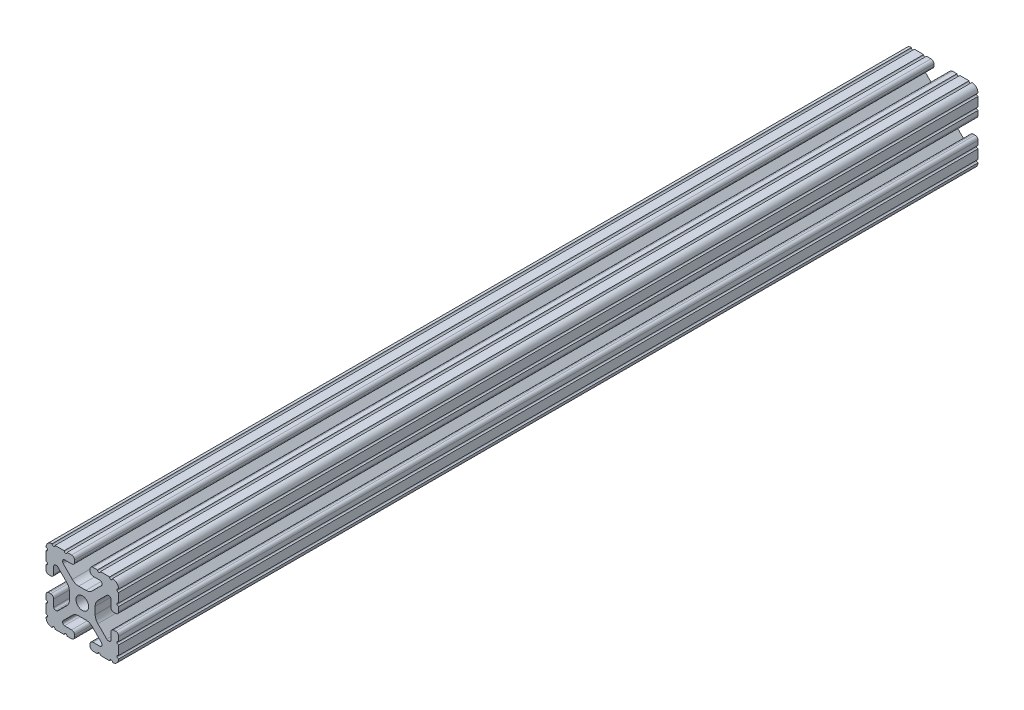
from build123d import *

# Parameters (mm, degrees)
SKETCH1_R      = 3.3274
EXTRUDE1_DEPTH = 450.85


with BuildPart() as part:
    # Sketch1 → Extrude1 (new body)
    with BuildSketch(Plane.XY):
        with BuildLine():
            Line((-10.022898969, 12.91475973), (-5.252158105, 8.144007132))
            ThreePointArc((-5.252158105, 8.144007132), (-3.715177372, 7.117027388), (-1.902183975, 6.7564))
            Line((-1.902183975, 6.7564), (1.902183975, 6.7564))
            ThreePointArc((1.902183975, 6.7564), (3.715177372, 7.117027388), (5.252158105, 8.144007132))
            Line((5.252158105, 8.144007132), (10.022898969, 12.91475973))
            ThreePointArc((10.022898969, 12.91475973), (10.218362387, 13.207291992), (10.287, 13.552357131))
            Line((10.287, 13.552357131), (10.287, 14.0843))
            ThreePointArc((10.287, 14.0843), (10.022898185, 14.721898185), (9.3853, 14.986))
            Line((9.3853, 14.986), (5.617617549, 14.986))
            ThreePointArc((5.617617549, 14.986), (4.519044045, 15.441044045), (4.064, 16.539617549))
            Line((4.064, 16.539617549), (4.064, 17.496382451))
            ThreePointArc((4.064, 17.496382451), (4.519044045, 18.594955955), (5.617617549, 19.05))
            Line((5.617617549, 19.05), (7.974178704, 19.05))
            ThreePointArc((7.974178704, 19.05), (8.736178704, 18.288), (9.498178704, 19.05))
            Line((9.498178704, 19.05), (14.327719207, 19.05))
            ThreePointArc((14.327719207, 19.05), (15.087603123, 18.231251131), (15.847487039, 19.05))
            ThreePointArc((15.847487039, 19.05), (18.120176289, 18.120192083), (19.05, 15.847509295))
            ThreePointArc((19.05, 15.847509295), (18.231250992, 15.08762539), (19.05, 14.327741484))
            Line((19.05, 14.327741484), (19.05, 9.496091471))
            ThreePointArc((19.05, 9.496091471), (18.231250992, 8.736207565), (19.05, 7.97632366))
            Line((19.05, 7.97632366), (19.05, 5.617617549))
            ThreePointArc((19.05, 5.617617549), (18.594955955, 4.519044045), (17.496382451, 4.064))
            Line((17.496382451, 4.064), (16.539617549, 4.064))
            ThreePointArc((16.539617549, 4.064), (15.441044045, 4.519044045), (14.986, 5.617617549))
            Line((14.986, 5.617617549), (14.986, 9.385342516))
            ThreePointArc((14.986, 9.385342516), (14.721898185, 10.022940701), (14.0843, 10.287042516))
            Line((14.0843, 10.287042516), (13.516042086, 10.287042516))
            ThreePointArc((13.516042086, 10.287042516), (13.170975923, 10.218404478), (12.878443117, 10.022939917))
            Line((12.878443117, 10.022939917), (8.14758008, 5.292065243))
            ThreePointArc((8.14758008, 5.292065243), (7.117955879, 3.751120653), (6.7564, 1.933453584))
            Line((6.7564, 1.933453584), (6.7564, -1.933453584))
            ThreePointArc((6.7564, -1.933453584), (7.117955879, -3.751120653), (8.14758008, -5.292065243))
            Line((8.14758008, -5.292065243), (12.878443117, -10.022939917))
            ThreePointArc((12.878443117, -10.022939917), (13.170975923, -10.218404478), (13.516042086, -10.287042516))
            Line((13.516042086, -10.287042516), (14.0843, -10.287042516))
            ThreePointArc((14.0843, -10.287042516), (14.721898185, -10.022940701), (14.986, -9.385342516))
            Line((14.986, -9.385342516), (14.986, -5.617617549))
            ThreePointArc((14.986, -5.617617549), (15.441044045, -4.519044045), (16.539617549, -4.064))
            Line((16.539617549, -4.064), (17.496382451, -4.064))
            ThreePointArc((17.496382451, -4.064), (18.594955955, -4.519044045), (19.05, -5.617617549))
            Line((19.05, -5.617617549), (19.05, -7.976318491))
            ThreePointArc((19.05, -7.976318491), (18.231250992, -8.736202396), (19.05, -9.496086302))
            Line((19.05, -9.496086302), (19.05, -14.32774291))
            ThreePointArc((19.05, -14.32774291), (18.231250992, -15.087626816), (19.05, -15.847510721))
            ThreePointArc((19.05, -15.847510721), (18.120175716, -18.120192644), (15.847486868, -19.05))
            ThreePointArc((15.847486868, -19.05), (15.087602952, -18.231251131), (14.327719036, -19.05))
            Line((14.327719036, -19.05), (9.496062448, -19.05))
            ThreePointArc((9.496062448, -19.05), (8.736178532, -18.231251131), (7.976294616, -19.05))
            Line((7.976294616, -19.05), (5.617617549, -19.05))
            ThreePointArc((5.617617549, -19.05), (4.519044045, -18.594955955), (4.064, -17.496382451))
            Line((4.064, -17.496382451), (4.064, -16.539617549))
            ThreePointArc((4.064, -16.539617549), (4.519044045, -15.441044045), (5.617617549, -14.986))
            Line((5.617617549, -14.986), (9.3853, -14.986))
            ThreePointArc((9.3853, -14.986), (10.022898185, -14.721898185), (10.287, -14.0843))
            Line((10.287, -14.0843), (10.287, -13.552357131))
            ThreePointArc((10.287, -13.552357131), (10.218362387, -13.207291992), (10.022898969, -12.91475973))
            Line((10.022898969, -12.91475973), (5.252158105, -8.144007132))
            ThreePointArc((5.252158105, -8.144007132), (3.715177372, -7.117027388), (1.902183975, -6.7564))
            Line((1.902183975, -6.7564), (-1.902183975, -6.7564))
            ThreePointArc((-1.902183975, -6.7564), (-3.715177372, -7.117027388), (-5.252158105, -8.144007132))
            Line((-5.252158105, -8.144007132), (-10.022898969, -12.91475973))
            ThreePointArc((-10.022898969, -12.91475973), (-10.218362387, -13.207291992), (-10.287, -13.552357131))
            Line((-10.287, -13.552357131), (-10.287, -14.0843))
            ThreePointArc((-10.287, -14.0843), (-10.022898185, -14.721898185), (-9.3853, -14.986))
            Line((-9.3853, -14.986), (-5.617617549, -14.986))
            ThreePointArc((-5.617617549, -14.986), (-4.519044045, -15.441044045), (-4.064, -16.539617549))
            Line((-4.064, -16.539617549), (-4.064, -17.496382451))
            ThreePointArc((-4.064, -17.496382451), (-4.519044045, -18.594955955), (-5.617617549, -19.05))
            Line((-5.617617549, -19.05), (-7.976294616, -19.05))
            ThreePointArc((-7.976294616, -19.05), (-8.736178532, -18.231251131), (-9.496062448, -19.05))
            Line((-9.496062448, -19.05), (-14.327719036, -19.05))
            ThreePointArc((-14.327719036, -19.05), (-15.087602952, -18.231251131), (-15.847486868, -19.05))
            ThreePointArc((-15.847486868, -19.05), (-18.120175716, -18.120192644), (-19.05, -15.847510721))
            ThreePointArc((-19.05, -15.847510721), (-18.231250992, -15.087626816), (-19.05, -14.32774291))
            Line((-19.05, -14.32774291), (-19.05, -9.496086302))
            ThreePointArc((-19.05, -9.496086302), (-18.231250992, -8.736202396), (-19.05, -7.976318491))
            Line((-19.05, -7.976318491), (-19.05, -5.617617549))
            ThreePointArc((-19.05, -5.617617549), (-18.594955955, -4.519044045), (-17.496382451, -4.064))
            Line((-17.496382451, -4.064), (-16.539617549, -4.064))
            ThreePointArc((-16.539617549, -4.064), (-15.441044045, -4.519044045), (-14.986, -5.617617549))
            Line((-14.986, -5.617617549), (-14.986, -9.385342516))
            ThreePointArc((-14.986, -9.385342516), (-14.721898185, -10.022940701), (-14.0843, -10.287042516))
            Line((-14.0843, -10.287042516), (-13.516042086, -10.287042516))
            ThreePointArc((-13.516042086, -10.287042516), (-13.170975923, -10.218404478), (-12.878443117, -10.022939917))
            Line((-12.878443117, -10.022939917), (-8.14758008, -5.292065243))
            ThreePointArc((-8.14758008, -5.292065243), (-7.117955879, -3.751120653), (-6.7564, -1.933453584))
            Line((-6.7564, -1.933453584), (-6.7564, 1.933453584))
            ThreePointArc((-6.7564, 1.933453584), (-7.117955879, 3.751120653), (-8.14758008, 5.292065243))
            Line((-8.14758008, 5.292065243), (-12.878443117, 10.022939917))
            ThreePointArc((-12.878443117, 10.022939917), (-13.170975923, 10.218404478), (-13.516042086, 10.287042516))
            Line((-13.516042086, 10.287042516), (-14.0843, 10.287042516))
            ThreePointArc((-14.0843, 10.287042516), (-14.721898185, 10.022940701), (-14.986, 9.385342516))
            Line((-14.986, 9.385342516), (-14.986, 5.617617549))
            ThreePointArc((-14.986, 5.617617549), (-15.441044045, 4.519044045), (-16.539617549, 4.064))
            Line((-16.539617549, 4.064), (-17.496382451, 4.064))
            ThreePointArc((-17.496382451, 4.064), (-18.594955955, 4.519044045), (-19.05, 5.617617549))
            Line((-19.05, 5.617617549), (-19.05, 7.97632366))
            ThreePointArc((-19.05, 7.97632366), (-18.231250992, 8.736207565), (-19.05, 9.496091471))
            Line((-19.05, 9.496091471), (-19.05, 14.327741484))
            ThreePointArc((-19.05, 14.327741484), (-18.231250992, 15.08762539), (-19.05, 15.847509295))
            ThreePointArc((-19.05, 15.847509295), (-18.120176289, 18.120192083), (-15.847487039, 19.05))
            ThreePointArc((-15.847487039, 19.05), (-15.087603123, 18.231251131), (-14.327719207, 19.05))
            Line((-14.327719207, 19.05), (-9.498178704, 19.05))
            ThreePointArc((-9.498178704, 19.05), (-8.736178704, 18.288), (-7.974178704, 19.05))
            Line((-7.974178704, 19.05), (-5.617617549, 19.05))
            ThreePointArc((-5.617617549, 19.05), (-4.519044045, 18.594955955), (-4.064, 17.496382451))
            Line((-4.064, 17.496382451), (-4.064, 16.539617549))
            ThreePointArc((-4.064, 16.539617549), (-4.519044045, 15.441044045), (-5.617617549, 14.986))
            Line((-5.617617549, 14.986), (-9.3853, 14.986))
            ThreePointArc((-9.3853, 14.986), (-10.022898185, 14.721898185), (-10.287, 14.0843))
            Line((-10.287, 14.0843), (-10.287, 13.552357131))
            ThreePointArc((-10.287, 13.552357131), (-10.218362387, 13.207291992), (-10.022898969, 12.91475973))
        make_face()
        Circle(SKETCH1_R, mode=Mode.SUBTRACT)
    extrude(amount=-EXTRUDE1_DEPTH)


solid = part.part
